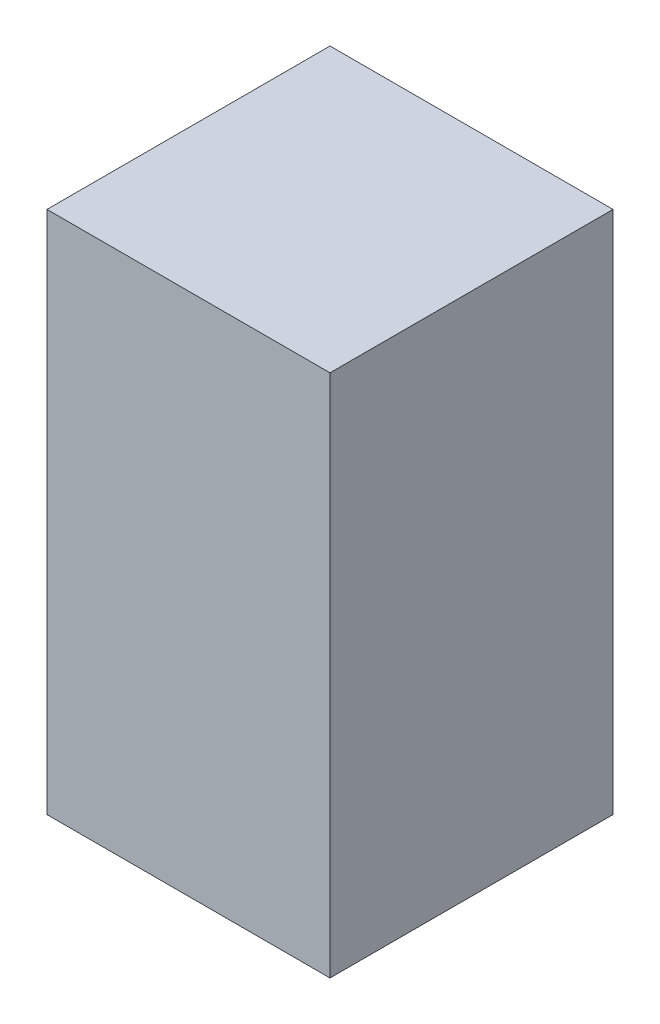
from build123d import *

# Parameters (mm, degrees)
SKETCH2_W           = 270
SKETCH2_H           = 270
BOSS_EXTRUDE1_DEPTH = 500


with BuildPart() as part:
    # Sketch2 → Boss-Extrude1 (new body)
    with BuildSketch(Plane(origin=(0, 0, 0), x_dir=(1, 0, 0), z_dir=(0, 1, 0))):
        with Locations((135, 135)):
            Rectangle(SKETCH2_W, SKETCH2_H)
    extrude(amount=BOSS_EXTRUDE1_DEPTH)


solid = part.part
